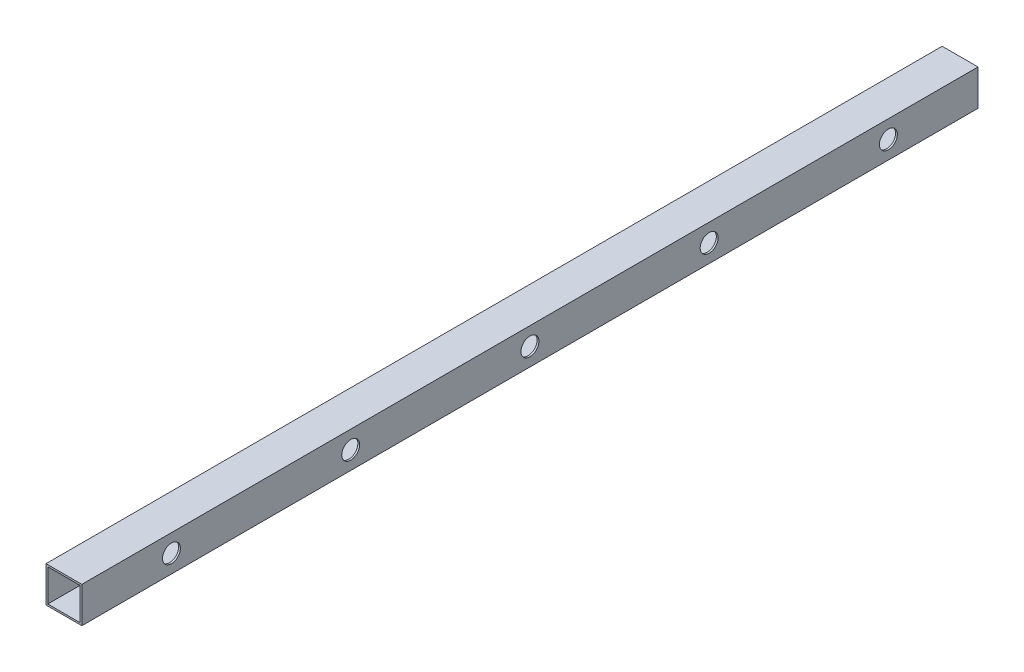
from build123d import *

# Parameters (mm, degrees)
CROQUIS1_W            = 40
CROQUIS1_H            = 40
CROQUIS1_W_2          = 36
CROQUIS1_H_2          = 36
EXTRUIR_L_MINA1_DEPTH = 1000
CROQUIS2_R            = 10
EXTRUIR1_DEPTH        = 10
CROQUIS3_W            = 60
CROQUIS3_H            = 30
EXTRUIR2_DEPTH        = 10


with BuildPart() as part:
    # Croquis1 → Extruir-Lámina1 (new body)
    with BuildSketch(Plane.XY):
        Rectangle(CROQUIS1_W, CROQUIS1_H)
        Rectangle(CROQUIS1_W_2, CROQUIS1_H_2, mode=Mode.SUBTRACT)
    extrude(amount=EXTRUIR_L_MINA1_DEPTH)

    # Croquis2 → Extruir1 (cut)
    with BuildSketch(Plane(origin=(20, 0, 0), x_dir=(0, 0, -1), z_dir=(1, 0, 0))):
        with Locations((-500, 0)):
            Circle(CROQUIS2_R)
        with Locations((-300, 0)):
            Circle(CROQUIS2_R)
        with Locations((-100, 0)):
            Circle(CROQUIS2_R)
        with Locations((-700, 0)):
            Circle(CROQUIS2_R)
        with Locations((-900, 0)):
            Circle(CROQUIS2_R)
    extrude(amount=-EXTRUIR1_DEPTH, mode=Mode.SUBTRACT)

    # Croquis3 → Extruir2 (cut)
    with BuildSketch(Plane.ZY.offset(20)):
        with Locations((100, 0)):
            Rectangle(CROQUIS3_W, CROQUIS3_H)
        with Locations((300, 0)):
            Rectangle(CROQUIS3_W, CROQUIS3_H)
        with Locations((500, 0)):
            Rectangle(CROQUIS3_W, CROQUIS3_H)
        with Locations((700, 0)):
            Rectangle(CROQUIS3_W, CROQUIS3_H)
        with Locations((900, 0)):
            Rectangle(CROQUIS3_W, CROQUIS3_H)
    extrude(amount=-EXTRUIR2_DEPTH, mode=Mode.SUBTRACT)


solid = part.part
